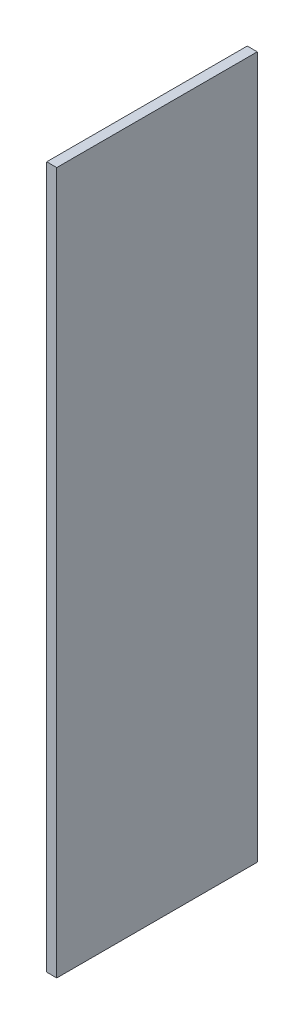
from build123d import *

# Parameters (mm, degrees)
CROQUIS1_W              = 10
CROQUIS1_H              = 700
SALIENTE_EXTRUIR1_DEPTH = 200


with BuildPart() as part:
    # Croquis1 → Saliente-Extruir1 (new body)
    with BuildSketch(Plane.XY):
        with Locations((5, 350)):
            Rectangle(CROQUIS1_W, CROQUIS1_H)
    extrude(amount=SALIENTE_EXTRUIR1_DEPTH)


solid = part.part
